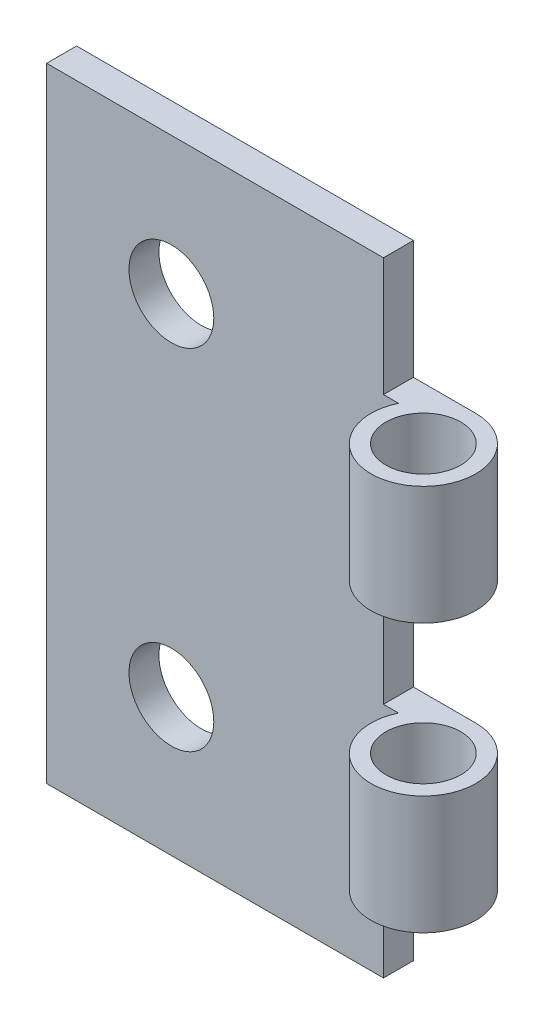
from build123d import *

# Parameters (mm, degrees)
SKETCH_1_W          = 13.5
SKETCH_1_H          = 25
SKETCH_1_R          = 1.7
SKETCH_1_W_2        = 2.5
SKETCH_1_H_2        = 4.75
EXTRUDE_1_DEPTH     = 1.2
SKETCH_2_R          = 2.1
EXTRUDE_2_DEPTH     = 15.5
SKETCH_3_R          = 1.5
CUT_EXTRUDE_1_DEPTH = 18
SKETCH_4_W          = 4.6
SKETCH_4_H          = 6
CUT_EXTRUDE_2_DEPTH = 5


with BuildPart() as part:
    # 草图1 → 凸台-拉伸1 (new body)
    # profile 1 of 3: a face of its own
    with BuildSketch(Plane.XY):
        Rectangle(SKETCH_1_W, SKETCH_1_H)
        with Locations((-1.75, -7)):
            Circle(SKETCH_1_R, mode=Mode.SUBTRACT)
        with Locations((-1.75, 7)):
            Circle(SKETCH_1_R, mode=Mode.SUBTRACT)
    # profile 2 of 3: a face of its own
    with BuildSketch(Plane.XY):
        with Locations((8, 5.375)):
            Rectangle(SKETCH_1_W_2, SKETCH_1_H_2)
    # profile 3 of 3: a face of its own
    with BuildSketch(Plane.XY):
        with Locations((8, -5.375)):
            Rectangle(SKETCH_1_W_2, SKETCH_1_H_2)
    extrude(amount=EXTRUDE_1_DEPTH)

    # 草图2 → 凸台-拉伸2 (add)
    with BuildSketch(Plane.XZ.offset(7.75)):
        with Locations(Location((9.25, 2.1, 0), (0, 0, 270))):
            Circle(SKETCH_2_R)
    extrude(amount=-EXTRUDE_2_DEPTH)

    # 草图3 → 切除-拉伸1 (cut)
    with BuildSketch(Plane.XZ.offset(7.75)):
        with Locations(Location((9.25, 2.1, 0), (0, 0, 270))):
            Circle(SKETCH_3_R)
    extrude(amount=-CUT_EXTRUDE_1_DEPTH, mode=Mode.SUBTRACT)

    # 草图4 → 切除-拉伸2 (cut, symmetric)
    with BuildSketch(Plane.XY.offset(1.2)):
        with Locations((9.05, 0)):
            Rectangle(SKETCH_4_W, SKETCH_4_H)
    extrude(amount=CUT_EXTRUDE_2_DEPTH, both=True, mode=Mode.SUBTRACT)


solid = part.part
